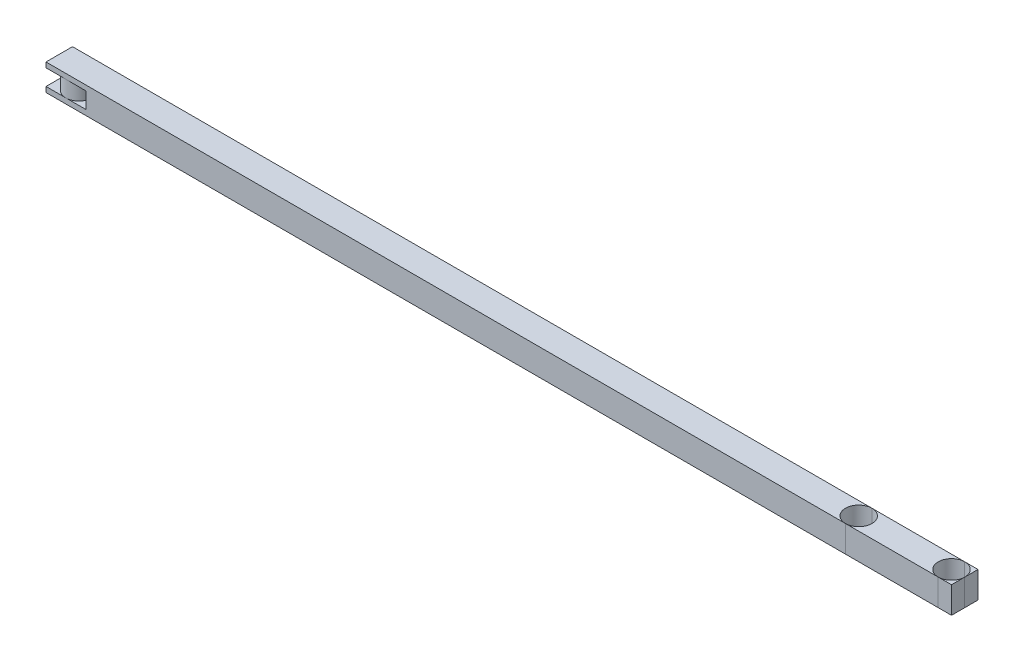
from build123d import *

# Parameters (mm, degrees)
BOSS_EXTRUDE1_DEPTH = 5
SKETCH8_R           = 2.5
BOSS_EXTRUDE4_DEPTH = 3.041317676
SKETCH9_R           = 2.5
CUT_EXTRUDE1_DEPTH  = 10
SKETCH10_R          = 2.5
CUT_EXTRUDE3_DEPTH  = 10


with BuildPart() as part:
    # Sketch1 → Boss-Extrude1 (new body)
    with BuildSketch(Plane.XY):
        Polygon((0, 0), (170.8, 0), (170.8, -5), (0, -5), (0, -4), (7.5, -4), (7.5, -0.958682324), (0, -0.958682324), align=None)
    extrude(amount=BOSS_EXTRUDE1_DEPTH)

    # Sketch8 → Boss-Extrude4 (add)
    with BuildSketch(Plane.XZ.offset(0.958682324)):
        with Locations(Location((3.75, 2.5, 0), (0, 0, 90))):
            Circle(SKETCH8_R)
    extrude(amount=BOSS_EXTRUDE4_DEPTH)

    # Sketch9 → Cut-Extrude1 (cut)
    with BuildSketch(Plane.XZ.offset(5)):
        with Locations((168.3, 2.5)):
            Circle(SKETCH9_R)
    extrude(amount=-CUT_EXTRUDE1_DEPTH, mode=Mode.SUBTRACT)


with BuildPart() as cut_extrude1_piece_1:
    # of the separate pieces the step leaves, piece 1, a body of its own (cut_extrude1_pieces)
    add(part.part.solids().sort_by_distance((0, 0, 0))[0])

    # Sketch10 → Cut-Extrude3 (cut)
    with BuildSketch(Plane(origin=(0, 0, 0), x_dir=(1, 0, 0), z_dir=(0, 1, 0))):
        with Locations((150.8, -2.5)):
            Circle(SKETCH10_R)
    extrude(amount=-CUT_EXTRUDE3_DEPTH, mode=Mode.SUBTRACT)


with BuildPart() as cut_extrude1_piece_2:
    # of the separate pieces the step leaves, piece 2, a body of its own (cut_extrude1_pieces)
    add(part.part.solids().sort_by_distance((170.8, -5, 0))[0])


with BuildPart() as cut_extrude1_piece_3:
    # of the separate pieces the step leaves, piece 3, a body of its own (cut_extrude1_pieces)
    add(part.part.solids().sort_by_distance((170.8, 0, 5))[0])


with BuildPart() as cut_extrude3_piece_1:
    # of the separate pieces the step leaves, piece 1, a body of its own (cut_extrude3_pieces)
    add(cut_extrude1_piece_1.part.solids().sort_by_distance((0, 0, 0))[0])


with BuildPart() as cut_extrude3_piece_2:
    # of the separate pieces the step leaves, piece 2, a body of its own (cut_extrude3_pieces)
    add(cut_extrude1_piece_1.part.solids().sort_by_distance((168.3, -5, 0))[0])


solid = Compound([cut_extrude1_piece_2.part, cut_extrude1_piece_3.part, cut_extrude3_piece_1.part, cut_extrude3_piece_2.part])
